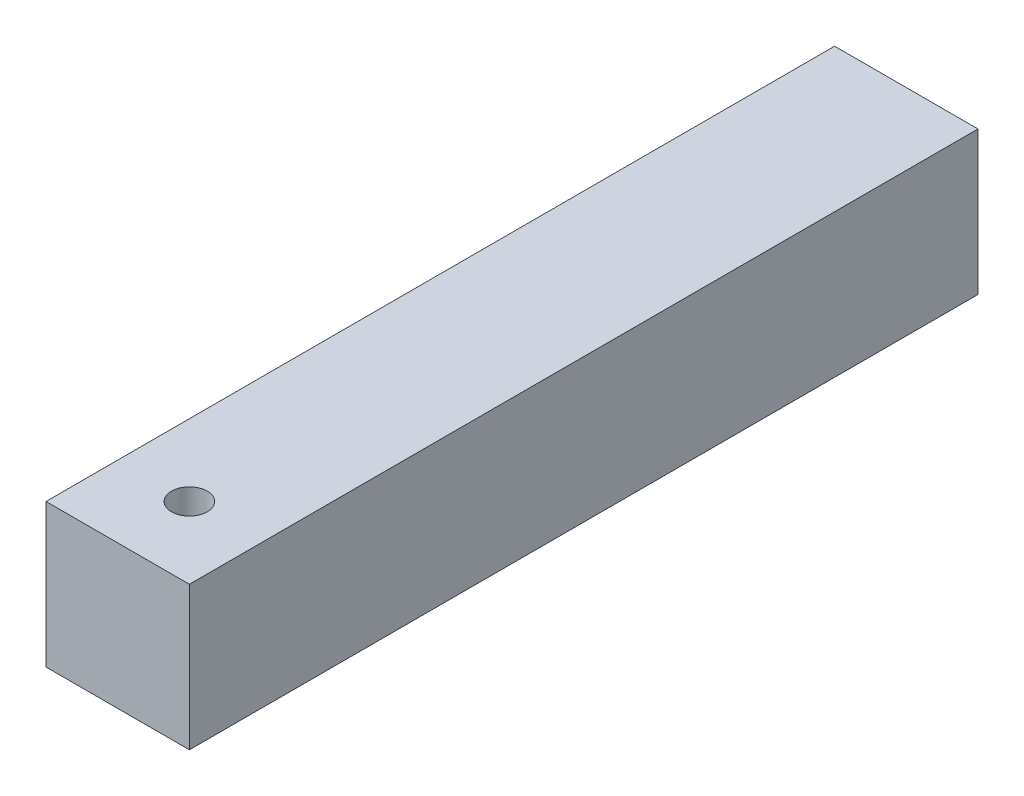
from build123d import *

# Parameters (mm, degrees)
SKETCH2_W           = 100
SKETCH2_H           = 100
BOSS_EXTRUDE1_DEPTH = 550
SKETCH3_R           = 12.5
CUT_EXTRUDE1_DEPTH  = 500


with BuildPart() as part:
    # Sketch2 → Boss-Extrude1 (new body)
    with BuildSketch(Plane.XY):
        Rectangle(SKETCH2_W, SKETCH2_H)
    extrude(amount=-BOSS_EXTRUDE1_DEPTH)

    # Sketch3 → Cut-Extrude1 (cut)
    with BuildSketch(Plane(origin=(0, 50, 0), x_dir=(1, 0, 0), z_dir=(0, 1, 0))):
        with Locations(Location((0, 50, 0), (0, 0, 180))):
            Circle(SKETCH3_R)
    extrude(amount=-CUT_EXTRUDE1_DEPTH, mode=Mode.SUBTRACT)


solid = part.part
